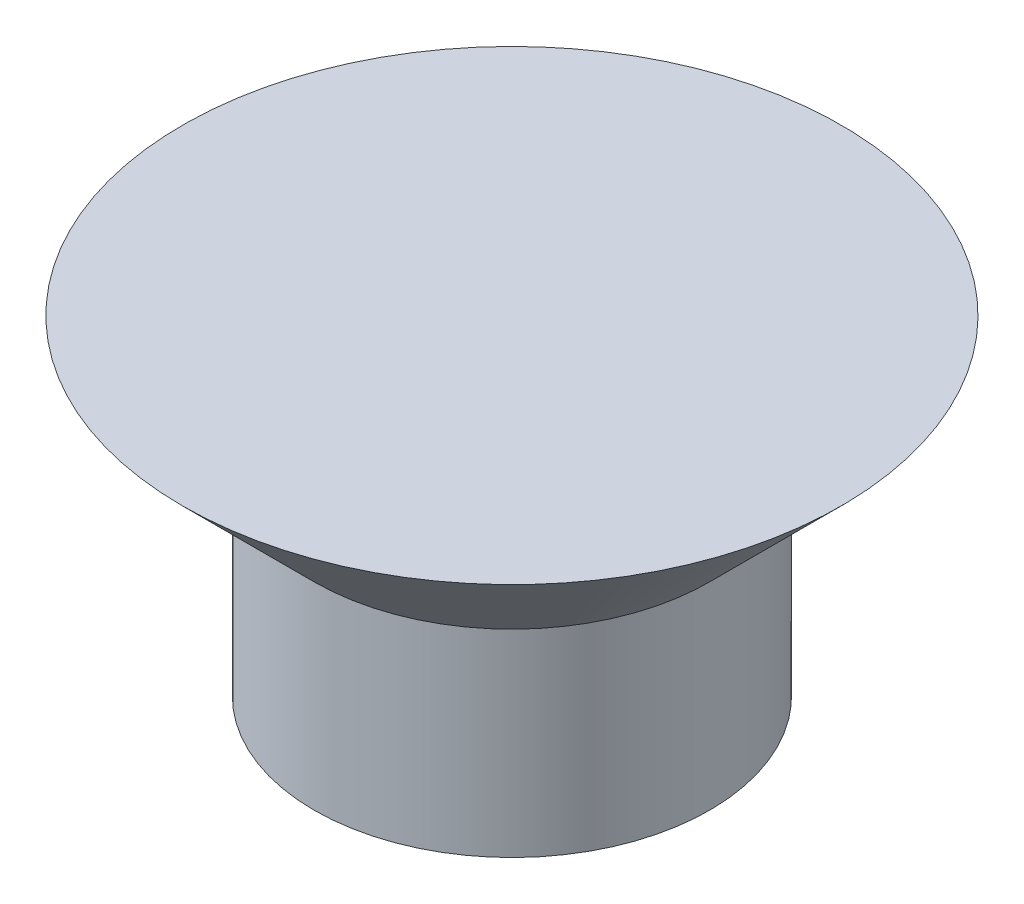
from build123d import *


with BuildPart() as part:
    # Sketch1 → Revolve1 (revolve)
    with BuildSketch(Plane.XY, mode=Mode.PRIVATE) as revolve1_sk:
        Polygon((-24.503753754, -36.496246246), (-22.003753754, -36.496246246), (-23.003753754, -37.496246246), (-23.003753754, -38.996246246), (-24.503753754, -38.996246246), align=None)
    revolve(revolve1_sk.sketch.rotate(Axis((-24.503753754, -36.496246246, 0), (0, -1, 0)), 90), axis=Axis((-24.503753754, -36.496246246, 0), (0, -1, 0)))


solid = part.part
